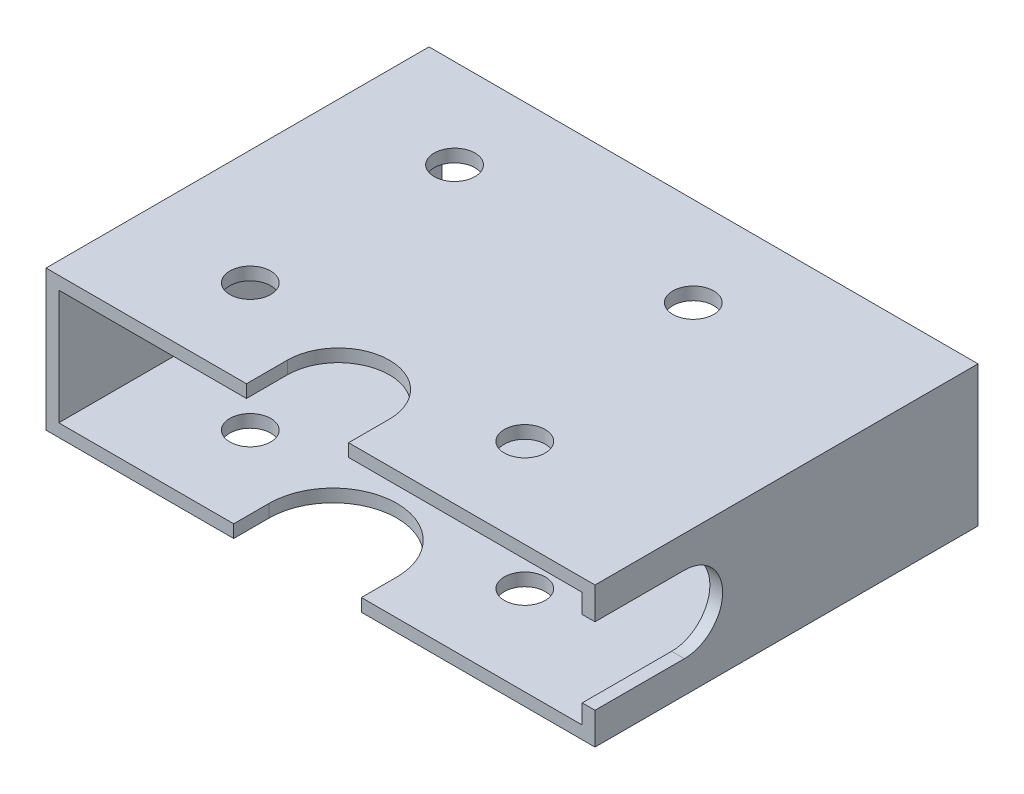
from build123d import *

# Parameters (mm, degrees)
SKETCH_2_W          = 41
SKETCH_2_H          = 9
EXTRUDE_1_DEPTH     = 30
SKETCH_3_R          = 1.6
CUT_EXTRUDE_1_DEPTH = 54.572380944
CUT_EXTRUDE_2_DEPTH = 2
CUT_EXTRUDE_3_DEPTH = 10
CUT_EXTRUDE_4_DEPTH = 10


with BuildPart() as part:
    # 草图2 → 凸台-拉伸1 (new body)
    with BuildSketch(Plane.XY):
        Polygon((0, 0), (-43, 0), (-43, 11), (0, 11), (0, 10), (0, 1), align=None)
        with Locations((-21.5, 5.5)):
            Rectangle(SKETCH_2_W, SKETCH_2_H, mode=Mode.SUBTRACT)
    extrude(amount=EXTRUDE_1_DEPTH)

    # 草图3 → 切除-拉伸1 (cut, through all)
    with BuildSketch(Plane(origin=(0, 11, 0), x_dir=(1, 0, 0), z_dir=(0, 1, 0))):
        with Locations(Location((-34, -7, 0), (0, 0, 270))):
            Circle(SKETCH_3_R)
        with Locations(Location((-34, -23, 0), (0, 0, 270))):
            Circle(SKETCH_3_R)
        with Locations(Location((-12.5, -23, 0), (0, 0, 270))):
            Circle(SKETCH_3_R)
        with Locations(Location((-15.3, -7, 0), (0, 0, 180))):
            Circle(SKETCH_3_R)
    extrude(amount=-CUT_EXTRUDE_1_DEPTH, mode=Mode.SUBTRACT)

    # 草图4 → 切除-拉伸2 (cut)
    with BuildSketch(Plane(origin=(0, 11, 0), x_dir=(1, 0, 0), z_dir=(0, 1, 0))):
        with BuildLine():
            Line((-27.3, -30), (-27.3, -26.8))
            ThreePointArc((-27.3, -26.8), (-23.3, -22.8), (-19.3, -26.8))
            Line((-19.3, -26.8), (-19.3, -30))
            Line((-19.3, -30), (-27.3, -30))
        make_face()
    extrude(amount=-CUT_EXTRUDE_2_DEPTH, mode=Mode.SUBTRACT)

    # 草图5 → 切除-拉伸3 (cut)
    with BuildSketch(Plane(origin=(0, 1, 0), x_dir=(1, 0, 0), z_dir=(0, 1, 0))):
        with BuildLine():
            Line((-28.3, -27.220720419), (-28.3, -30))
            Line((-28.3, -30), (-18.3, -30))
            Line((-18.3, -30), (-18.3, -27.220720419))
            ThreePointArc((-18.3, -27.220720419), (-23.3, -22.220720419), (-28.3, -27.220720419))
        make_face()
    extrude(amount=-CUT_EXTRUDE_3_DEPTH, mode=Mode.SUBTRACT)

    # 草图6 → 切除-拉伸4 (cut)
    with BuildSketch(Plane(origin=(0, 0, 0), x_dir=(0, 0, -1), z_dir=(1, 0, 0))):
        with BuildLine():
            Line((-23, 8.5), (-30, 8.5))
            Line((-30, 8.5), (-30, 2.5))
            Line((-30, 2.5), (-23, 2.5))
            ThreePointArc((-23, 2.5), (-20, 5.5), (-23, 8.5))
        make_face()
    extrude(amount=-CUT_EXTRUDE_4_DEPTH, mode=Mode.SUBTRACT)


solid = part.part
